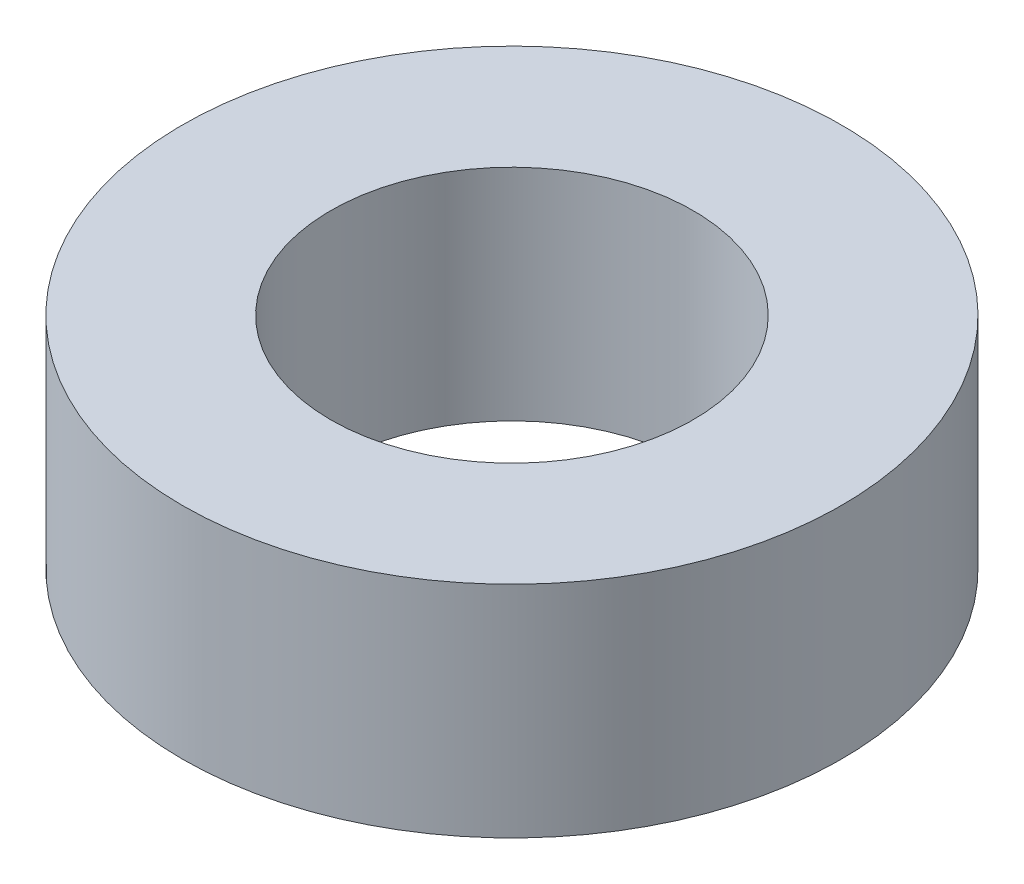
from build123d import *

# Parameters (mm, degrees)
SKETCH1_R           = 3
SKETCH1_R_2         = 1.65
BOSS_EXTRUDE3_DEPTH = 2


with BuildPart() as part:
    # Sketch1 → Boss-Extrude3 (new body)
    with BuildSketch(Plane(origin=(0, 0, 0), x_dir=(1, 0, 0), z_dir=(0, 1, 0))):
        with Locations(Location((0, 0, 0), (0, 0, 270))):
            Circle(SKETCH1_R)
        with Locations(Location((0, 0, 0), (0, 0, 270))):
            Circle(SKETCH1_R_2, mode=Mode.SUBTRACT)
    extrude(amount=BOSS_EXTRUDE3_DEPTH)


solid = part.part
